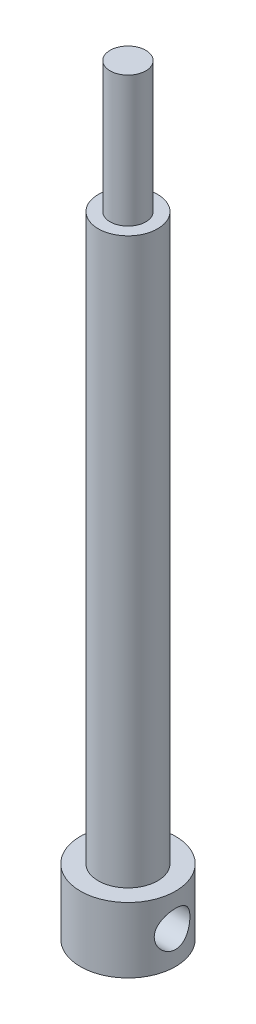
from build123d import *

# Parameters (mm, degrees)
SCHIZZO1_R                    = 8
ESTRUSIONE_ESTRUSIONE1_DEPTH  = 128
TAGLIO_ESTRUSIONE1_START      = -22
SCHIZZO2_R                    = 8
SCHIZZO2_R_2                  = 3
TAGLIO_ESTRUSIONE1_DEPTH      = 22
TAGLIO_ESTRUSIONE2_START      = -95
SCHIZZO5_R                    = 8
SCHIZZO5_R_2                  = 5
TAGLIO_ESTRUSIONE2_DEPTH      = 95
TAGLIO_ESTRUSIONE3_DEPTH      = 129.499027234
TAGLIO_ESTRUSIONE3_DEPTH_BACK = 129.499027234
SCHIZZO9_R                    = 3


with BuildPart() as part:
    # Schizzo1 → Estrusione-Estrusione1 (new body)
    with BuildSketch(Plane(origin=(0, 0, 0), x_dir=(1, 0, 0), z_dir=(0, 1, 0))):
        with Locations(Location((0, 0, 0), (0, 0, 270))):
            Circle(SCHIZZO1_R)
    extrude(amount=ESTRUSIONE_ESTRUSIONE1_DEPTH)

    # Schizzo2 → Taglio-Estrusione1 (cut)
    with BuildSketch(Plane(origin=(0, 128, 0), x_dir=(1, 0, 0), z_dir=(0, 1, 0)).offset(TAGLIO_ESTRUSIONE1_START)):
        with Locations(Location((0, 0, 0), (0, 0, 270))):
            Circle(SCHIZZO2_R)
        with Locations(Location((0, 0, 0), (0, 0, 270))):
            Circle(SCHIZZO2_R_2, mode=Mode.SUBTRACT)
    extrude(amount=TAGLIO_ESTRUSIONE1_DEPTH, mode=Mode.SUBTRACT)

    # Schizzo5 → Taglio-Estrusione2 (cut)
    with BuildSketch(Plane(origin=(0, 106, 0), x_dir=(1, 0, 0), z_dir=(0, 1, 0)).offset(TAGLIO_ESTRUSIONE2_START)):
        with Locations(Location((0, 0, 0), (0, 0, 270))):
            Circle(SCHIZZO5_R)
        with Locations(Location((0, 0, 0), (0, 0, 270))):
            Circle(SCHIZZO5_R_2, mode=Mode.SUBTRACT)
    extrude(amount=TAGLIO_ESTRUSIONE2_DEPTH, mode=Mode.SUBTRACT)

    # Schizzo9 → Taglio-Estrusione3 (cut, two sides: drawn at the far end of the back side and taken through both)
    with BuildSketch(Plane(origin=(0, 0, 0), x_dir=(0, 0, -1), z_dir=(1, 0, 0)).offset(-TAGLIO_ESTRUSIONE3_DEPTH_BACK)):
        with Locations((0, 5.5)):
            Circle(SCHIZZO9_R)
    extrude(amount=TAGLIO_ESTRUSIONE3_DEPTH + TAGLIO_ESTRUSIONE3_DEPTH_BACK, mode=Mode.SUBTRACT)


solid = part.part
